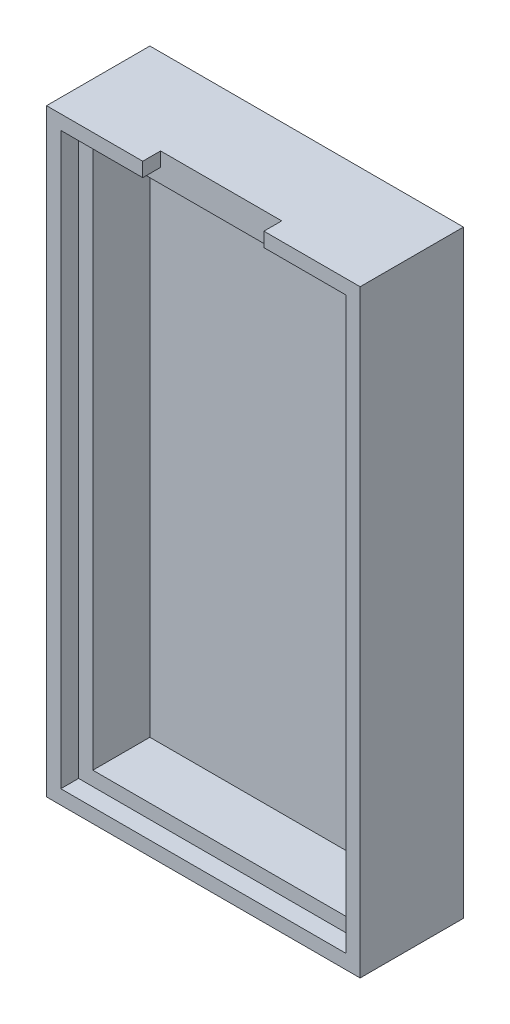
from build123d import *

# Parameters (mm, degrees)
SKETCH1_W           = 27.94
SKETCH1_H           = 53.34
BOSS_EXTRUDE1_DEPTH = 4.60375
SHELL1_T            = -2.54
SKETCH2_W           = 10.795
SKETCH2_H           = 1.5875
CUT_EXTRUDE1_DEPTH  = 2.54
SKETCH3_W           = 25.4
SKETCH3_H           = 50.8
CUT_EXTRUDE2_DEPTH  = 1.5875


with BuildPart() as part:
    # Sketch1 → Boss-Extrude1 (new, symmetric)
    with BuildSketch(Plane.XY):
        Rectangle(SKETCH1_W, SKETCH1_H)
    extrude(amount=BOSS_EXTRUDE1_DEPTH, both=True)

    # Shell1
    shell1_openings = [part.faces().sort_by_distance(p)[0] for p in [
        (0, 0, 4.60375),
    ]]
    offset(amount=SHELL1_T, openings=shell1_openings, kind=Kind.INTERSECTION)

    # Sketch2 → Cut-Extrude1 (cut)
    with BuildSketch(Plane(origin=(0, 26.67, 0), x_dir=(1, 0, 0), z_dir=(0, 1, 0))):
        with Locations((0, -3.81)):
            Rectangle(SKETCH2_W, SKETCH2_H)
    extrude(amount=-CUT_EXTRUDE1_DEPTH, mode=Mode.SUBTRACT)

    # Sketch3 → Cut-Extrude2 (cut)
    with BuildSketch(Plane.XY.offset(4.60375)):
        Rectangle(SKETCH3_W, SKETCH3_H)
    extrude(amount=-CUT_EXTRUDE2_DEPTH, mode=Mode.SUBTRACT)


solid = part.part
